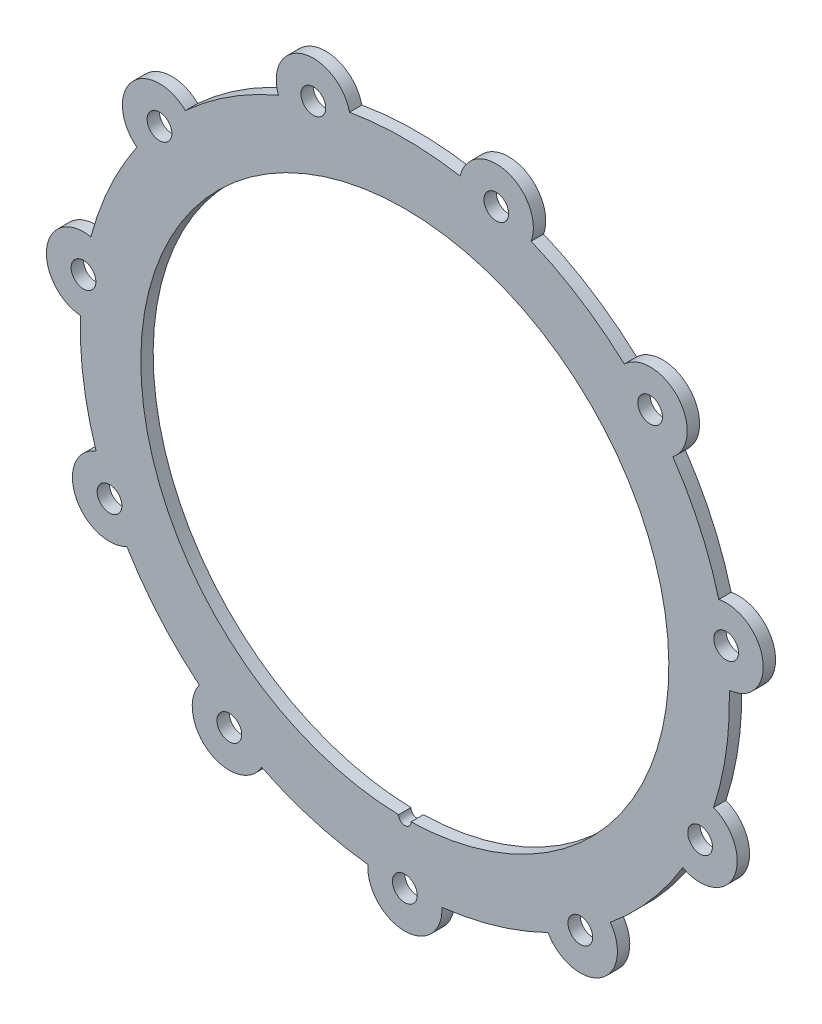
from build123d import *

# Parameters (mm, degrees)
SKETCH_1_R          = 42.7
SKETCH_1_R_2        = 2
EXTRUDE_1_DEPTH     = 2
SKETCH_2_R          = 1
CUT_EXTRUDE_1_DEPTH = 2


with BuildPart() as part:
    # 草图1 → 凸台-拉伸1 (new body)
    with BuildSketch(Plane.XY):
        with BuildLine():
            ThreePointArc((-70.701698086, -22.554916187), (-69.461279061, -27.140293833), (-65.275895868, -29.386823389))
            ThreePointArc((-65.275895868, -29.386823389), (-64.762769434, -38.351863236), (-62.729367044, -47.098320399))
            ThreePointArc((-62.729367044, -47.098320399), (-66.112292293, -50.433008431), (-66.010615464, -55.182112487))
            ThreePointArc((-66.010615464, -55.182112487), (-62.488066258, -58.368956475), (-57.752532286, -57.99606841))
            ThreePointArc((-57.752532286, -57.99606841), (-52.473996389, -65.260522759), (-46.034697694, -71.519170416))
            ThreePointArc((-46.034697694, -71.519170416), (-47.077727048, -76.153435976), (-44.424631557, -80.093665897))
            ThreePointArc((-44.424631557, -80.093665897), (-39.738336654, -80.870175779), (-35.956150478, -77.996259418))
            ThreePointArc((-35.956150478, -77.996259418), (-27.58810297, -81.253715341), (-18.787339807, -83.037477084))
            ThreePointArc((-18.787339807, -83.037477084), (-17.159318816, -87.4999736), (-12.797143736, -89.380334226))
            ThreePointArc((-12.797143736, -89.380334226), (-8.434968656, -87.4999736), (-6.806947664, -83.037477084))
            ThreePointArc((-6.806947664, -83.037477084), (1.993815499, -81.253715341), (10.361863007, -77.996259418))
            ThreePointArc((10.361863007, -77.996259418), (14.144049183, -80.870175779), (18.830344086, -80.093665897))
            ThreePointArc((18.830344086, -80.093665897), (21.483439576, -76.153435976), (20.440410223, -71.519170416))
            ThreePointArc((20.440410223, -71.519170416), (26.879708918, -65.260522759), (32.158244814, -57.99606841))
            ThreePointArc((32.158244814, -57.99606841), (36.893778787, -58.368956475), (40.416327993, -55.182112487))
            ThreePointArc((40.416327993, -55.182112487), (40.518004822, -50.433008431), (37.135079573, -47.098320399))
            ThreePointArc((37.135079573, -47.098320399), (39.168481963, -38.351863236), (39.681608397, -29.386823389))
            ThreePointArc((39.681608397, -29.386823389), (43.866991589, -27.140293833), (45.107410614, -22.554916187))
            ThreePointArc((45.107410614, -22.554916187), (42.625387107, -18.504744978), (37.976620826, -17.528374363))
            ThreePointArc((37.976620826, -17.528374363), (34.958536021, -9.071046044), (30.543338974, -1.251757506))
            ThreePointArc((30.543338974, -1.251757506), (32.849741796, 2.90093241), (31.414206364, 7.429018709))
            ThreePointArc((31.414206364, 7.429018709), (27.136507447, 9.49435633), (22.697850582, 7.802418757))
            ThreePointArc((22.697850582, 7.802418757), (15.586499181, 13.285476247), (7.644772521, 17.476444614))
            ThreePointArc((7.644772521, 17.476444614), (7.339928372, 22.216845183), (3.68421084, 25.25000473))
            ThreePointArc((3.68421084, 25.25000473), (-1.031024306, 24.67477866), (-3.850329562, 20.851711124))
            ThreePointArc((-3.850329562, 20.851711124), (-12.797143736, 21.619665774), (-21.743957909, 20.851711124))
            ThreePointArc((-21.743957909, 20.851711124), (-24.563263165, 24.67477866), (-29.278498311, 25.25000473))
            ThreePointArc((-29.278498311, 25.25000473), (-32.934215843, 22.216845183), (-33.239059992, 17.476444613))
            ThreePointArc((-33.239059992, 17.476444613), (-41.180786652, 13.285476247), (-48.292138053, 7.802418757))
            ThreePointArc((-48.292138053, 7.802418757), (-52.730794918, 9.49435633), (-57.008493835, 7.429018709))
            ThreePointArc((-57.008493835, 7.429018709), (-58.444029267, 2.90093241), (-56.137626446, -1.251757506))
            ThreePointArc((-56.137626446, -1.251757506), (-60.552823492, -9.071046044), (-63.570908298, -17.528374363))
            ThreePointArc((-63.570908298, -17.528374363), (-68.219674578, -18.504744978), (-70.701698086, -22.554916187))
        make_face()
        with Locations((-12.797143736, -30.880334226)):
            Circle(SKETCH_1_R, mode=Mode.SUBTRACT)
        with Locations((-64.762769434, -23.408805217)):
            Circle(SKETCH_1_R_2, mode=Mode.SUBTRACT)
        with Locations((-52.473996389, 3.499854306)):
            Circle(SKETCH_1_R_2, mode=Mode.SUBTRACT)
        with Locations((-27.58810297, 19.493046888)):
            Circle(SKETCH_1_R_2, mode=Mode.SUBTRACT)
        with Locations((1.993815499, 19.493046888)):
            Circle(SKETCH_1_R_2, mode=Mode.SUBTRACT)
        with Locations((26.879708918, 3.499854306)):
            Circle(SKETCH_1_R_2, mode=Mode.SUBTRACT)
        with Locations((39.168481963, -23.408805217)):
            Circle(SKETCH_1_R_2, mode=Mode.SUBTRACT)
        with Locations((34.958536021, -52.689622409)):
            Circle(SKETCH_1_R_2, mode=Mode.SUBTRACT)
        with Locations((15.586499181, -75.0461447)):
            Circle(SKETCH_1_R_2, mode=Mode.SUBTRACT)
        with Locations((-12.797143736, -83.380334226)):
            Circle(SKETCH_1_R_2, mode=Mode.SUBTRACT)
        with Locations((-41.180786652, -75.0461447)):
            Circle(SKETCH_1_R_2, mode=Mode.SUBTRACT)
        with Locations((-60.552823492, -52.689622409)):
            Circle(SKETCH_1_R_2, mode=Mode.SUBTRACT)
    extrude(amount=EXTRUDE_1_DEPTH)

    # 草图2 → 切除-拉伸1 (cut)
    with BuildSketch(Plane.XY.offset(2)):
        with Locations((-12.797143736, -73.580334226)):
            Circle(SKETCH_2_R)
    extrude(amount=-CUT_EXTRUDE_1_DEPTH, mode=Mode.SUBTRACT)


solid = part.part
